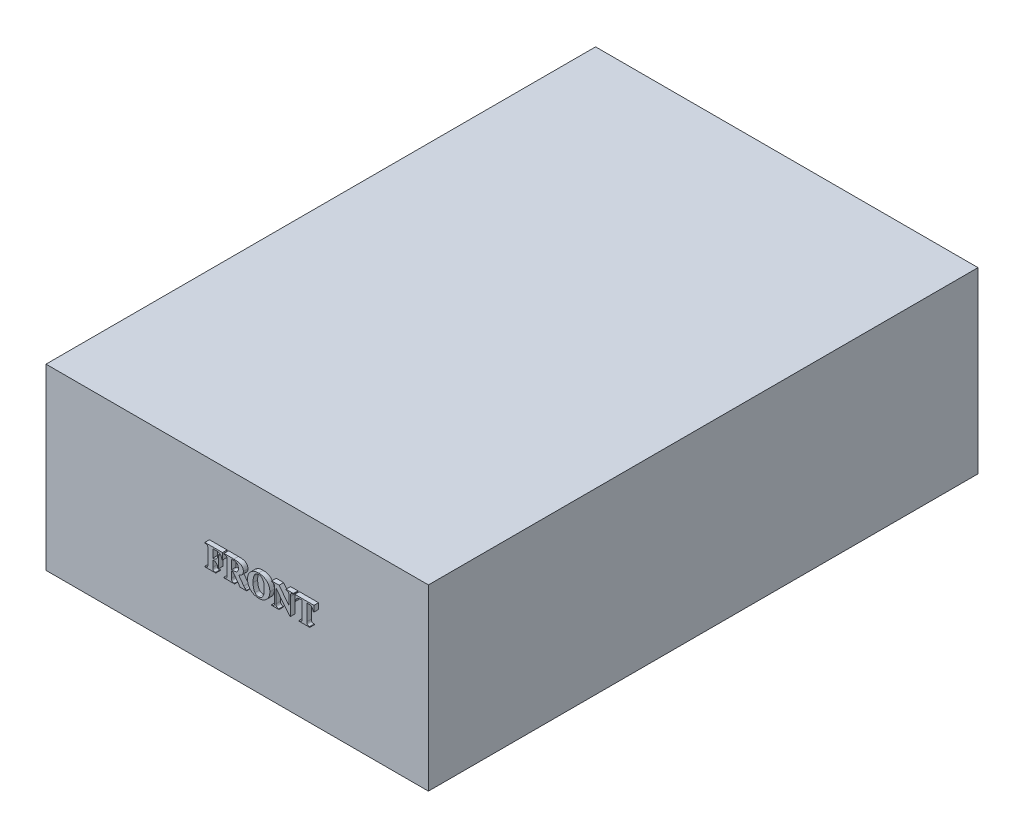
from build123d import *

# Parameters (mm, degrees)
SKETCH1_W        = 212.09
SKETCH1_H        = 99.06
EXTRUDE1_DEPTH   = 304.8
EXTRUDE2_DEPTH   = 2.54
EXTRUDE2_2_DEPTH = 2.54
EXTRUDE2_3_DEPTH = 2.54
EXTRUDE2_4_DEPTH = 2.54
EXTRUDE2_5_DEPTH = 2.54


with BuildPart() as part:
    # Sketch1 → Extrude1 (new body)
    with BuildSketch(Plane.XY):
        with Locations((0, 49.53)):
            Rectangle(SKETCH1_W, SKETCH1_H)
    extrude(amount=-EXTRUDE1_DEPTH)


with BuildPart() as body_2:
    # Sketch2 → Extrude2 (new body)
    with BuildSketch(Plane.XY):
        with BuildLine():
            Line((-10.99840617, 59.227654631), (-10.99840617, 54.661754747))
            Line((-10.99840617, 54.661754747), (-10.672270464, 54.661754747))
            add(Edge.make_bspline(
                [(-10.672270464, 54.661754747), (-10.553189256, 54.664187615), (-10.325822721, 54.668832788), (-10.001447036, 54.7174259), (-9.711750613, 54.798054357), (-9.451622702, 54.911281701), (-9.218588365, 55.066904992), (-9.007086463, 55.263927194), (-8.817123307, 55.50709918), (-8.64277164, 55.791353023), (-8.492014069, 56.126396773), (-8.370780268, 56.514603741), (-8.28069655, 56.956195192), (-8.244974844, 57.269632166), (-8.226252669, 57.433908248)],
                knots=[0, 0, 0, 0, 1.028542631, 1.963837777, 2.825873281, 3.621069556, 4.404835347, 5.235844713, 6.108193202, 7.063662138, 8.111534847, 9.274524626, 10.571545628, 12, 12, 12, 12], degree=3))
            Line((-8.226252669, 57.433908248), (-7.900116963, 57.433908248))
            Line((-7.900116963, 57.433908248), (-7.900116963, 51.07426198))
            Line((-7.900116963, 51.07426198), (-8.226252669, 51.07426198))
            add(Edge.make_bspline(
                [(-8.226252669, 51.07426198), (-8.240986117, 51.209482429), (-8.269257657, 51.468952586), (-8.332243519, 51.83943729), (-8.413045171, 52.174333255), (-8.510744557, 52.473590038), (-8.628537476, 52.735416278), (-8.760364448, 52.96276746), (-8.911024569, 53.153968168), (-9.133420947, 53.356275479), (-9.437990983, 53.551116891), (-9.828289062, 53.72244359), (-10.242888843, 53.828565375), (-10.528121391, 53.840422965), (-10.672270464, 53.846415482)],
                knots=[0, 0, 0, 0, 1.177008708, 2.258524035, 3.249721952, 4.156223051, 4.97866621, 5.729978183, 6.425618934, 7.075817341, 8.32348227, 9.534762487, 10.754133406, 12, 12, 12, 12], degree=3))
            Line((-10.672270464, 53.846415482), (-10.99840617, 53.846415482))
            Line((-10.99840617, 53.846415482), (-10.99840617, 50.258922715))
            add(Edge.make_bspline(
                [(-10.99840617, 50.258922715), (-10.997463114, 50.19012934), (-10.995658487, 50.058486746), (-10.994558459, 49.871571391), (-10.987578591, 49.704918474), (-10.973305993, 49.559050137), (-10.961952936, 49.433096663), (-10.947270204, 49.326483234), (-10.927935229, 49.241087324), (-10.897298141, 49.153397418), (-10.84113155, 49.062087398), (-10.756574451, 48.961840574), (-10.647398589, 48.870174971), (-10.516600826, 48.785296142), (-10.360351796, 48.713267064), (-10.177876334, 48.664066155), (-9.971789101, 48.633163945), (-9.826479428, 48.629941856), (-9.74991792, 48.628244185)],
                knots=[0, 0, 0, 0, 1.354319329, 2.591617395, 3.679490877, 4.636117144, 5.476222309, 6.168990776, 6.752950479, 7.19717785, 7.991448918, 8.845577426, 9.770411191, 10.785995884, 11.908144457, 13.141369476, 14.493830035, 16, 16, 16, 16], degree=3))
            Line((-9.74991792, 48.628244185), (-9.36772764, 48.628244185))
            Line((-9.36772764, 48.628244185), (-9.36772764, 48.302108479))
            Line((-9.36772764, 48.302108479), (-15.401238201, 48.302108479))
            Line((-15.401238201, 48.302108479), (-15.401238201, 48.628244185))
            Line((-15.401238201, 48.628244185), (-15.016499985, 48.628244185))
            add(Edge.make_bspline(
                [(-15.016499985, 48.628244185), (-14.936515515, 48.629738265), (-14.784270057, 48.632582152), (-14.567907363, 48.666381386), (-14.374775614, 48.719909083), (-14.260761961, 48.776836833), (-14.206256591, 48.804051714)],
                knots=[0, 0, 0, 0, 1.144467932, 2.17842344, 3.129177061, 4, 4, 4, 4], degree=3))
            add(Edge.make_bspline(
                [(-14.206256591, 48.804051714), (-14.170448623, 48.825652901), (-14.098017347, 48.869347129), (-14.00499309, 48.961903364), (-13.926162177, 49.074728273), (-13.885691783, 49.160084695), (-13.864833273, 49.204077541)],
                knots=[0, 0, 0, 0, 0.93343552, 1.888125192, 2.911536119, 4, 4, 4, 4], degree=3))
            add(Edge.make_bspline(
                [(-13.864833273, 49.204077541), (-13.85651107, 49.224259262), (-13.837553427, 49.27023241), (-13.823458421, 49.352675759), (-13.803020371, 49.453029474), (-13.792706795, 49.57514371), (-13.782302541, 49.717776165), (-13.774192632, 49.880047312), (-13.773342126, 50.062737737), (-13.771523285, 50.190980305), (-13.770559671, 50.258922715)],
                knots=[0, 0, 0, 0, 0.491154816, 1.118830903, 1.878082211, 2.802823963, 3.878617243, 5.106317376, 6.466938293, 8, 8, 8, 8], degree=3))
            Line((-13.770559671, 50.258922715), (-13.770559671, 58.08617966))
            add(Edge.make_bspline(
                [(-13.770559671, 58.08617966), (-13.771534655, 58.154970928), (-13.773400378, 58.286609488), (-13.774089177, 58.473551989), (-13.782368263, 58.640052142), (-13.792555239, 58.785276681), (-13.80367478, 58.911462983), (-13.82282828, 59.016347741), (-13.838040349, 59.102648622), (-13.870103277, 59.189066591), (-13.921168013, 59.283503624), (-14.00770402, 59.383041695), (-14.116346312, 59.474994793), (-14.247307914, 59.559785342), (-14.403506238, 59.631841749), (-14.585997123, 59.681034316), (-14.792921778, 59.712064847), (-14.939086347, 59.715198502), (-15.016499985, 59.71685819)],
                knots=[0, 0, 0, 0, 1.353963977, 2.590937397, 3.678525439, 4.633585292, 5.456840327, 6.168525469, 6.732370981, 7.176481794, 7.976852204, 8.830756602, 9.755347706, 10.770665926, 11.892520065, 13.125421506, 14.477527201, 16, 16, 16, 16], degree=3))
            Line((-15.016499985, 59.71685819), (-15.401238201, 59.71685819))
            Line((-15.401238201, 59.71685819), (-15.401238201, 60.042993896))
            Line((-15.401238201, 60.042993896), (-5.617167021, 60.042993896))
            Line((-5.617167021, 60.042993896), (-5.617167021, 56.45550113))
            Line((-5.617167021, 56.45550113), (-5.943302727, 56.45550113))
            add(Edge.make_bspline(
                [(-5.943302727, 56.45550113), (-5.954031042, 56.554180006), (-5.974828118, 56.745471167), (-6.024082188, 57.020822623), (-6.082607252, 57.276818144), (-6.150143026, 57.514107299), (-6.231379722, 57.731693599), (-6.325938853, 57.928244783), (-6.430616628, 58.10637387), (-6.587228387, 58.317311534), (-6.821222545, 58.548670813), (-7.153052569, 58.780231413), (-7.539477645, 58.967910052), (-7.822202067, 59.051688397), (-7.968911213, 59.095162)],
                knots=[0, 0, 0, 0, 0.991432477, 1.92191355, 2.792593541, 3.614306461, 4.384971491, 5.109852849, 5.790897148, 6.445967782, 7.729964095, 9.057683145, 10.473195948, 12, 12, 12, 12], degree=3))
            add(Edge.make_bspline(
                [(-7.968911213, 59.095162), (-8.015531033, 59.105808121), (-8.117562749, 59.129108126), (-8.2859577, 59.156431432), (-8.481528072, 59.178836479), (-8.704281396, 59.195632093), (-8.953941455, 59.211543111), (-9.230919412, 59.221201438), (-9.535027009, 59.225648466), (-9.746519384, 59.226966524), (-9.856931199, 59.227654631)],
                knots=[0, 0, 0, 0, 0.605076936, 1.324265919, 2.157537778, 3.095682767, 4.151012068, 5.323391552, 6.602648453, 8, 8, 8, 8], degree=3))
            Line((-9.856931199, 59.227654631), (-10.99840617, 59.227654631))
        make_face()
    extrude(amount=EXTRUDE2_DEPTH)


with BuildPart() as body_3:
    # Sketch2 → Extrude2 2 (new body)
    with BuildSketch(Plane.XY):
        with BuildLine():
            Line((-0.562063577, 53.683347629), (-0.562063577, 50.258922715))
            add(Edge.make_bspline(
                [(-0.562063577, 50.258922715), (-0.561482656, 50.188421195), (-0.560369662, 50.053346404), (-0.554585311, 49.861443225), (-0.549726334, 49.689466346), (-0.531658666, 49.539549257), (-0.51906271, 49.408924055), (-0.497753082, 49.299479487), (-0.476852901, 49.209064226), (-0.439352391, 49.117483976), (-0.377883881, 49.021809674), (-0.285211801, 48.921105908), (-0.168504166, 48.835188829), (-0.025640899, 48.755841439), (0.162664884, 48.694154141), (0.409386565, 48.659353004), (0.717138898, 48.62952439), (0.944506576, 48.628696234), (1.068614953, 48.628244185)],
                knots=[0, 0, 0, 0, 1.201607785, 2.302176191, 3.273050139, 4.131548176, 4.87492358, 5.508079405, 6.031227576, 6.453276293, 7.188288546, 7.956616343, 8.773076426, 9.647656452, 10.732595485, 12.127198207, 13.886035732, 16, 16, 16, 16], degree=3))
            Line((1.068614953, 48.628244185), (1.068614953, 48.302108479))
            Line((1.068614953, 48.302108479), (-4.801827755, 48.302108479))
            Line((-4.801827755, 48.302108479), (-4.801827755, 48.628244185))
            add(Edge.make_bspline(
                [(-4.801827755, 48.628244185), (-4.676897149, 48.628849304), (-4.447883714, 48.629958563), (-4.137987025, 48.658063657), (-3.891830317, 48.697053036), (-3.703600772, 48.7582716), (-3.563084659, 48.839850227), (-3.44761625, 48.92685501), (-3.356236542, 49.026602068), (-3.293260313, 49.120528709), (-3.256915151, 49.210927869), (-3.234790441, 49.30017063), (-3.21517463, 49.409175023), (-3.197114669, 49.539141362), (-3.184920261, 49.68969353), (-3.178165658, 49.861395525), (-3.172977587, 50.05336029), (-3.171776254, 50.188425957), (-3.171149225, 50.258922715)],
                knots=[0, 0, 0, 0, 2.130106643, 3.904752054, 5.302927616, 6.375002966, 7.257314602, 8.062903242, 8.831833611, 9.555194011, 9.977573727, 10.487113911, 11.120766299, 11.86655625, 12.724382924, 13.696018294, 14.797449837, 16, 16, 16, 16], degree=3))
            Line((-3.171149225, 50.258922715), (-3.171149225, 58.08617966))
            add(Edge.make_bspline(
                [(-3.171149225, 58.08617966), (-3.171775854, 58.156676531), (-3.172976419, 58.291742416), (-3.178169668, 58.483705713), (-3.184907792, 58.655412383), (-3.197153138, 58.805950099), (-3.215058992, 58.93596016), (-3.235271516, 59.045645486), (-3.256395171, 59.136034553), (-3.293845849, 59.227617523), (-3.355323294, 59.323312236), (-3.448043465, 59.423916769), (-3.565131092, 59.510687958), (-3.709018046, 59.588078484), (-3.896689106, 59.650948423), (-4.14221082, 59.689916586), (-4.450557085, 59.714169373), (-4.677765967, 59.715908554), (-4.801827755, 59.71685819)],
                knots=[0, 0, 0, 0, 1.201552591, 2.302070444, 3.272899798, 4.130014864, 4.875186147, 5.50831289, 6.031437031, 6.453466362, 7.188444853, 7.956737359, 8.773159939, 9.660425799, 10.731611811, 12.128627521, 13.886132833, 16, 16, 16, 16], degree=3))
            Line((-4.801827755, 59.71685819), (-4.801827755, 60.042993896))
            Line((-4.801827755, 60.042993896), (0.630370098, 60.042993896))
            add(Edge.make_bspline(
                [(0.630370098, 60.042993896), (0.801087634, 60.041828162), (1.13152983, 60.039571757), (1.609003952, 60.027654367), (2.050821536, 60.005008804), (2.457065824, 59.972520254), (2.827475625, 59.929215525), (3.163577749, 59.879423773), (3.462846675, 59.81869553), (3.731469742, 59.749997227), (3.975423964, 59.666261445), (4.205798066, 59.570917421), (4.42198399, 59.454043558), (4.630665995, 59.327411161), (4.826047486, 59.181635124), (5.011372706, 59.02100428), (5.180582917, 58.841067202), (5.341942912, 58.651332753), (5.486740732, 58.447574203), (5.614309793, 58.234008347), (5.721928359, 58.011522576), (5.808672647, 57.780144467), (5.87784898, 57.540939495), (5.926335542, 57.292001387), (5.954249313, 57.034524521), (5.958499718, 56.859840247), (5.960650543, 56.771445095)],
                knots=[0, 0, 0, 0, 1.72662054, 3.342060189, 4.830092444, 6.200416371, 7.462989327, 8.601282075, 9.635622143, 10.550256632, 11.403195303, 12.242354894, 13.068488357, 13.886138304, 14.709050263, 15.530840692, 16.363158174, 17.204513028, 18.048276074, 18.887963052, 19.717794674, 20.544196029, 21.384278329, 22.233315354, 23.106007916, 24, 24, 24, 24], degree=3))
            add(Edge.make_bspline(
                [(5.960650543, 56.771445095), (5.957605327, 56.664292203), (5.951634261, 56.454186638), (5.907805862, 56.145717792), (5.833533256, 55.852245767), (5.732111955, 55.572039748), (5.597469173, 55.308192095), (5.436094827, 55.056700467), (5.245170273, 54.818635348), (5.097644838, 54.675543629), (5.023010388, 54.603152237)],
                knots=[0, 0, 0, 0, 1.055875917, 2.070363217, 3.063103869, 4.034981426, 5.000784238, 5.975972407, 6.976026164, 8, 8, 8, 8], degree=3))
            add(Edge.make_bspline(
                [(5.023010388, 54.603152237), (4.915959464, 54.514601391), (4.69379517, 54.33083057), (4.295983387, 54.116764969), (3.844891696, 53.927941921), (3.517600396, 53.837598781), (3.346469025, 53.790360907)],
                knots=[0, 0, 0, 0, 0.884570304, 1.835761235, 2.868380718, 4, 4, 4, 4], degree=3))
            Line((3.346469025, 53.790360907), (6.172129165, 49.886924176))
            add(Edge.make_bspline(
                [(6.172129165, 49.886924176), (6.216376364, 49.825834787), (6.300585162, 49.709572873), (6.419773219, 49.542286872), (6.532048376, 49.395212628), (6.633894669, 49.2652053), (6.724489414, 49.152903087), (6.807559276, 49.059981161), (6.879037497, 48.984315665), (6.926082154, 48.942244249), (6.946701467, 48.923804669)],
                knots=[0, 0, 0, 0, 1.4621376, 2.782658633, 3.981171578, 5.048212647, 5.984136403, 6.77709185, 7.464008716, 8, 8, 8, 8], degree=3))
            add(Edge.make_bspline(
                [(6.946701467, 48.923804669), (7.005749853, 48.881760503), (7.123454381, 48.797951461), (7.32264585, 48.710157832), (7.533635512, 48.649068202), (7.680095777, 48.635252875), (7.754396926, 48.628244185)],
                knots=[0, 0, 0, 0, 0.994168701, 1.981733386, 2.976107756, 4, 4, 4, 4], degree=3))
            Line((7.754396926, 48.628244185), (7.754396926, 48.302108479))
            Line((7.754396926, 48.302108479), (4.141424808, 48.302108479))
            Line((4.141424808, 48.302108479), (0.245631882, 53.683347629))
            Line((0.245631882, 53.683347629), (-0.562063577, 53.683347629))
        make_face()
        with BuildLine():
            Line((-0.562063577, 59.390722484), (-0.562063577, 54.335619041))
            Line((-0.562063577, 54.335619041), (-0.044832731, 54.335619041))
            add(Edge.make_bspline(
                [(-0.044832731, 54.335619041), (0.057092315, 54.335895686), (0.254204748, 54.33643069), (0.540571912, 54.346546999), (0.806432989, 54.364676569), (1.053004559, 54.386871705), (1.279282146, 54.416742918), (1.485626392, 54.455475056), (1.672450398, 54.497485295), (1.891658867, 54.56460618), (2.140875585, 54.673539282), (2.410457088, 54.847294657), (2.641008539, 55.071338815), (2.840783862, 55.334328712), (2.999529438, 55.643338502), (3.110039427, 55.996560411), (3.176326306, 56.391023986), (3.184316994, 56.667554712), (3.188497042, 56.812212058)],
                knots=[0, 0, 0, 0, 1.034226387, 2.000086228, 2.907011593, 3.737991848, 4.511957121, 5.221904592, 5.867871331, 6.453975968, 7.546048523, 8.616933773, 9.689759286, 10.791177541, 11.955248141, 13.195348709, 14.532845086, 16, 16, 16, 16], degree=3))
            add(Edge.make_bspline(
                [(3.188497042, 56.812212058), (3.186682531, 56.918460622), (3.183161603, 57.124628399), (3.152077114, 57.422719857), (3.102878987, 57.700460595), (3.027301195, 57.955450709), (2.938017346, 58.19223851), (2.821694371, 58.403912744), (2.688704308, 58.596371579), (2.53142139, 58.764653519), (2.353562036, 58.916373953), (2.147299531, 59.041611974), (1.919859457, 59.153480428), (1.664633071, 59.238085298), (1.386002216, 59.306514985), (1.082989237, 59.357913104), (0.75400283, 59.384555683), (0.526797498, 59.388613365), (0.408699735, 59.390722484)],
                knots=[0, 0, 0, 0, 1.16430214, 2.25924543, 3.281782595, 4.251104685, 5.170830437, 6.049791735, 6.891787854, 7.728466103, 8.567626776, 9.445897571, 10.366094373, 11.340588595, 12.386009021, 13.509395102, 14.705422703, 16, 16, 16, 16], degree=3))
            Line((0.408699735, 59.390722484), (-0.562063577, 59.390722484))
        make_face(mode=Mode.SUBTRACT)
    extrude(amount=EXTRUDE2_2_DEPTH)


with BuildPart() as body_4:
    # Sketch2 → Extrude2 3 (new body)
    with BuildSketch(Plane.XY):
        with BuildLine():
            add(Edge.make_bspline(
                [(14.363740844, 60.206061749), (14.590633571, 60.209599463), (15.034331688, 60.216517609), (15.6852228, 60.15262507), (16.303970866, 60.036714168), (16.890922096, 59.864489743), (17.44279095, 59.629751435), (17.963796679, 59.34060554), (18.451855571, 58.992845053), (18.901041487, 58.590277269), (19.30568025, 58.146816656), (19.662927376, 57.673325641), (19.96510159, 57.172398281), (20.210886188, 56.643369468), (20.403613138, 56.087867533), (20.536741142, 55.504226097), (20.62100036, 54.894372083), (20.631440278, 54.478584728), (20.636757314, 54.26682479)],
                knots=[0, 0, 0, 0, 1.117599178, 2.185511443, 3.216596641, 4.216496892, 5.193720437, 6.166199278, 7.147635958, 8.140749636, 9.133263309, 10.101842832, 11.059452728, 12.010747998, 12.971773146, 13.951566087, 14.956735376, 16, 16, 16, 16], degree=3))
            add(Edge.make_bspline(
                [(20.636757314, 54.26682479), (20.632945951, 54.084900349), (20.625425789, 53.725947103), (20.562518726, 53.19587031), (20.460023955, 52.682485842), (20.321309991, 52.183669192), (20.136713017, 51.703062343), (19.910002296, 51.240942813), (19.64980259, 50.791088431), (19.442048419, 50.511822275), (19.33731036, 50.371031864)],
                knots=[0, 0, 0, 0, 1.043246653, 2.058419255, 3.056808262, 4.043829632, 5.024555343, 6.005002729, 6.994233708, 8, 8, 8, 8], degree=3))
            add(Edge.make_bspline(
                [(19.33731036, 50.371031864), (19.26452355, 50.280059542), (19.120362869, 50.099880854), (18.886298764, 49.848077279), (18.645983205, 49.609238872), (18.388910206, 49.39352798), (18.124585384, 49.191413884), (17.848338052, 49.00697293), (17.560235997, 48.841827146), (17.261678669, 48.693486726), (16.951485088, 48.563772821), (16.631606879, 48.447981679), (16.298029532, 48.35495707), (15.954773288, 48.275440333), (15.600013515, 48.214282127), (15.235031787, 48.172400999), (14.859406419, 48.141802263), (14.605010083, 48.139970589), (14.475849992, 48.139040626)],
                knots=[0, 0, 0, 0, 1.00627325, 1.9930127, 2.968556301, 3.931628562, 4.889992766, 5.842467438, 6.799060146, 7.757311971, 8.720859362, 9.702647782, 10.694476427, 11.710892394, 12.745970349, 13.802697082, 14.884402792, 16, 16, 16, 16], degree=3))
            add(Edge.make_bspline(
                [(14.475849992, 48.139040626), (14.346705551, 48.140223349), (14.091553035, 48.142560072), (13.714175801, 48.169722641), (13.347505703, 48.209109571), (12.991838552, 48.267552081), (12.648299559, 48.345851373), (12.313326848, 48.432074859), (11.992611745, 48.543228172), (11.682579408, 48.669053701), (11.381934282, 48.807778949), (11.093328951, 48.966105063), (10.817849727, 49.143081631), (10.552544463, 49.334523786), (10.296653212, 49.540388168), (10.054339014, 49.766217793), (9.822123468, 50.007891841), (9.677159367, 50.179962241), (9.604197884, 50.266566521)],
                knots=[0, 0, 0, 0, 1.12499151, 2.222661784, 3.294793131, 4.33735381, 5.360698186, 6.364076506, 7.349253377, 8.315262806, 9.278632822, 10.232406028, 11.180767221, 12.129590213, 13.081869556, 14.040110377, 15.013573345, 16, 16, 16, 16], degree=3))
            add(Edge.make_bspline(
                [(9.604197884, 50.266566521), (9.495486011, 50.408295821), (9.279269607, 50.69018039), (9.001973982, 51.142395494), (8.768900455, 51.614582564), (8.577323302, 52.105677851), (8.42642665, 52.616099293), (8.319831354, 53.146378088), (8.254298655, 53.696127034), (8.247202566, 54.069600375), (8.243600485, 54.259180984)],
                knots=[0, 0, 0, 0, 0.995754374, 1.980450006, 2.952842694, 3.929288476, 4.917067138, 5.917621276, 6.942953664, 8, 8, 8, 8], degree=3))
            add(Edge.make_bspline(
                [(8.243600485, 54.259180984), (8.249058337, 54.470909522), (8.259774744, 54.886635223), (8.342087458, 55.497323804), (8.482737946, 56.079977537), (8.677488842, 56.636468037), (8.924938158, 57.16682784), (9.230246634, 57.668935237), (9.59264743, 58.142663266), (10.005488124, 58.584801234), (10.45685175, 58.986722285), (10.938558894, 59.33761792), (11.448297208, 59.625517313), (11.982262054, 59.859975484), (12.541831825, 60.036223288), (13.127829582, 60.152395548), (13.738075356, 60.216340112), (14.152976063, 60.209524169), (14.363740844, 60.206061749)],
                knots=[0, 0, 0, 0, 1.060255294, 2.081794832, 3.079505486, 4.0575798, 5.030022739, 6.005429218, 6.99491703, 8.012249652, 9.030720031, 10.017772549, 10.991257006, 11.957043232, 12.933793802, 13.923226749, 14.945023109, 16, 16, 16, 16], degree=3))
        make_face()
        with BuildLine():
            add(Edge.make_bspline(
                [(14.465658252, 59.553790337), (14.335282212, 59.549266607), (14.080663873, 59.540431973), (13.712011242, 59.460328769), (13.366412902, 59.336656414), (13.046353732, 59.156284753), (12.748467796, 58.929085781), (12.479822668, 58.645593833), (12.233468577, 58.315258759), (12.095814705, 58.068409437), (12.024736327, 57.940947353)],
                knots=[0, 0, 0, 0, 1.010341478, 1.973149883, 2.913323355, 3.848402755, 4.811842333, 5.809142135, 6.868737798, 8, 8, 8, 8], degree=3))
            add(Edge.make_bspline(
                [(12.024736327, 57.940947353), (11.968936504, 57.825559131), (11.853445478, 57.586735716), (11.720213786, 57.197578775), (11.602018706, 56.774957107), (11.505920831, 56.316197463), (11.433393345, 55.820848864), (11.380788121, 55.290303458), (11.346582253, 54.724203437), (11.343484633, 54.334821752), (11.341889692, 54.13433216)],
                knots=[0, 0, 0, 0, 0.787943638, 1.630837067, 2.525905988, 3.487208031, 4.51219802, 5.604605297, 6.766629954, 8, 8, 8, 8], degree=3))
            add(Edge.make_bspline(
                [(11.341889692, 54.13433216), (11.344105598, 53.896413291), (11.348392625, 53.436120932), (11.401518601, 52.770273767), (11.480456671, 52.152135529), (11.594224846, 51.582174377), (11.741392314, 51.059406836), (11.921157843, 50.584544825), (12.133634359, 50.155333324), (12.308797904, 49.901232481), (12.394186931, 49.777362962)],
                knots=[0, 0, 0, 0, 1.253361503, 2.424829634, 3.517270749, 4.535371114, 5.484506921, 6.375489106, 7.20808062, 8, 8, 8, 8], degree=3))
            add(Edge.make_bspline(
                [(12.394186931, 49.777362962), (12.456880641, 49.698410939), (12.579418032, 49.544096018), (12.792820942, 49.343380541), (13.021888454, 49.16998983), (13.274358745, 49.034189313), (13.540465331, 48.921675555), (13.827006382, 48.846446593), (14.131163182, 48.799510797), (14.340629711, 48.794087415), (14.447822705, 48.791312038)],
                knots=[0, 0, 0, 0, 1.020058884, 1.99374635, 2.959073536, 3.921751619, 4.889988268, 5.879249688, 6.914721236, 8, 8, 8, 8], degree=3))
            add(Edge.make_bspline(
                [(14.447822705, 48.791312038), (14.590170777, 48.795242796), (14.865517213, 48.80284613), (15.258738929, 48.88863343), (15.62037544, 49.016356274), (15.830050893, 49.150688693), (15.933268929, 49.216817217)],
                knots=[0, 0, 0, 0, 1.086516288, 2.101667992, 3.065498145, 4, 4, 4, 4], degree=3))
            add(Edge.make_bspline(
                [(15.933268929, 49.216817217), (15.995239627, 49.264220483), (16.121180649, 49.360556588), (16.297653724, 49.526423385), (16.459319522, 49.716490473), (16.61351459, 49.923622698), (16.755756619, 50.151507373), (16.889032317, 50.398610111), (17.007094525, 50.668242495), (17.121079083, 50.95612083), (17.218758082, 51.267254347), (17.307154207, 51.600077273), (17.375329979, 51.956501539), (17.438644214, 52.334132652), (17.482514642, 52.734871736), (17.516605329, 53.157953958), (17.532857148, 53.604237664), (17.536567196, 53.90925612), (17.538468107, 54.065537909)],
                knots=[0, 0, 0, 0, 0.707878774, 1.438598863, 2.192768746, 2.969795667, 3.780358143, 4.628744544, 5.515519471, 6.450279976, 7.437595481, 8.473401936, 9.573958948, 10.729714514, 11.947871327, 13.231394215, 14.581454142, 16, 16, 16, 16], degree=3))
            add(Edge.make_bspline(
                [(17.538468107, 54.065537909), (17.536907251, 54.249858424), (17.533885246, 54.606725163), (17.513395464, 55.124168886), (17.480800347, 55.605994171), (17.435963576, 56.052390769), (17.376445362, 56.462608502), (17.298040237, 56.835999301), (17.215081222, 57.175247671), (17.111130532, 57.479051566), (16.996742051, 57.752947675), (16.881447103, 58.007429705), (16.752530344, 58.238069104), (16.622232651, 58.45198005), (16.477712936, 58.639712724), (16.330373506, 58.810800465), (16.17196543, 58.957848153), (15.954761869, 59.127672525), (15.664179505, 59.301248302), (15.286401832, 59.446116065), (14.884707096, 59.540091152), (14.607180358, 59.549163818), (14.465658252, 59.553790337)],
                knots=[0, 0, 0, 0, 1.564715362, 3.029477591, 4.395383686, 5.663787164, 6.837420581, 7.912070591, 8.901835802, 9.800165859, 10.634314221, 11.421391877, 12.170015688, 12.876189058, 13.5452815, 14.178775877, 14.79090283, 15.376466922, 16.517763855, 17.647800425, 18.800518316, 20, 20, 20, 20], degree=3))
        make_face(mode=Mode.SUBTRACT)
    extrude(amount=EXTRUDE2_3_DEPTH)


with BuildPart() as body_5:
    # Sketch2 → Extrude2 4 (new body)
    with BuildSketch(Plane.XY):
        with BuildLine():
            Line((25.763202943, 60.042993896), (31.23616776, 53.094774597))
            Line((31.23616776, 53.094774597), (31.23616776, 57.760043954))
            add(Edge.make_bspline(
                [(31.23616776, 57.760043954), (31.234991496, 57.846680182), (31.232741413, 58.012407145), (31.221300694, 58.249774983), (31.197258282, 58.464660481), (31.169394308, 58.659535619), (31.125002055, 58.830852062), (31.077540494, 58.981691481), (31.020158209, 59.111283283), (30.969703324, 59.184963103), (30.945703146, 59.220010825)],
                knots=[0, 0, 0, 0, 1.37708922, 2.634242248, 3.774587307, 4.813165717, 5.759297908, 6.583135444, 7.326031535, 8, 8, 8, 8], degree=3))
            add(Edge.make_bspline(
                [(30.945703146, 59.220010825), (30.910229737, 59.260946206), (30.839178175, 59.342937841), (30.712573604, 59.448490479), (30.568754533, 59.535110679), (30.408187086, 59.604187241), (30.231158845, 59.657243627), (30.037542898, 59.695366838), (29.826736038, 59.715191785), (29.68111652, 59.716288574), (29.605489229, 59.71685819)],
                knots=[0, 0, 0, 0, 0.876036587, 1.754659902, 2.655600339, 3.585565811, 4.577428142, 5.642743129, 6.775761992, 8, 8, 8, 8], degree=3))
            Line((29.605489229, 59.71685819), (29.605489229, 60.042993896))
            Line((29.605489229, 60.042993896), (33.682185555, 60.042993896))
            Line((33.682185555, 60.042993896), (33.682185555, 59.71685819))
            add(Edge.make_bspline(
                [(33.682185555, 59.71685819), (33.561297496, 59.70164315), (33.340549934, 59.673859738), (33.043911435, 59.611913209), (32.809742448, 59.549252489), (32.630061687, 59.474639875), (32.492738293, 59.378246631), (32.380335533, 59.260777203), (32.279811729, 59.121618028), (32.192107165, 58.952121204), (32.125533529, 58.737213186), (32.083722089, 58.46637014), (32.056542732, 58.134293325), (32.053279271, 57.891755736), (32.051507025, 57.760043954)],
                knots=[0, 0, 0, 0, 1.47293099, 2.689644668, 3.661742309, 4.402208035, 5.02909861, 5.67554278, 6.359727415, 7.099337769, 7.973129416, 9.067356349, 10.407406766, 12, 12, 12, 12], degree=3))
            Line((32.051507025, 57.760043954), (32.051507025, 48.139040626))
            Line((32.051507025, 48.139040626), (31.67696055, 48.139040626))
            Line((31.67696055, 48.139040626), (24.061182227, 57.813550593))
            Line((24.061182227, 57.813550593), (24.061182227, 50.258922715))
            add(Edge.make_bspline(
                [(24.061182227, 50.258922715), (24.063053767, 50.182465437), (24.066656448, 50.035286516), (24.082662215, 49.82378657), (24.115945038, 49.63206245), (24.161516195, 49.459570647), (24.21953474, 49.306252972), (24.290241175, 49.170998068), (24.378490813, 49.058376545), (24.508006678, 48.932122442), (24.692388917, 48.81266179), (24.928395296, 48.705126956), (25.18041414, 48.639045595), (25.354297776, 48.631870062), (25.442163107, 48.628244185)],
                knots=[0, 0, 0, 0, 1.127047964, 2.169547561, 3.122229636, 3.990523395, 4.794755099, 5.533929617, 6.229880341, 6.893690072, 8.19195966, 9.44115978, 10.706989644, 12, 12, 12, 12], degree=3))
            Line((25.442163107, 48.628244185), (25.691860757, 48.628244185))
            Line((25.691860757, 48.628244185), (25.691860757, 48.302108479))
            Line((25.691860757, 48.302108479), (21.615164432, 48.302108479))
            Line((21.615164432, 48.302108479), (21.615164432, 48.628244185))
            add(Edge.make_bspline(
                [(21.615164432, 48.628244185), (21.688242913, 48.630005826), (21.828673674, 48.63339107), (22.031326438, 48.650898482), (22.217392011, 48.680238541), (22.385373884, 48.724782907), (22.537601422, 48.773994298), (22.671671298, 48.837689765), (22.787192232, 48.915413596), (22.888772347, 49.002378746), (22.974782496, 49.105199935), (23.048586114, 49.222555632), (23.109621765, 49.357476772), (23.160108282, 49.506796827), (23.198036923, 49.67251994), (23.225180663, 49.853091045), (23.244000407, 50.05045001), (23.24521199, 50.1875325), (23.245842962, 50.258922715)],
                knots=[0, 0, 0, 0, 1.302254148, 2.502467739, 3.622024049, 4.653421555, 5.596190003, 6.46934253, 7.287800068, 8.07079221, 8.843923894, 9.666846287, 10.533548967, 11.476317415, 12.471093534, 13.558375583, 14.728443775, 16, 16, 16, 16], degree=3))
            Line((23.245842962, 50.258922715), (23.245842962, 58.84546435))
            Line((23.245842962, 58.84546435), (23.105706526, 59.021271879))
            add(Edge.make_bspline(
                [(23.105706526, 59.021271879), (23.047317546, 59.085989304), (22.937359245, 59.20786535), (22.767636171, 59.363267554), (22.608048801, 59.482805052), (22.453668089, 59.57391005), (22.286253099, 59.632526209), (22.097332107, 59.680073408), (21.876451954, 59.704687965), (21.71881494, 59.712651625), (21.635547914, 59.71685819)],
                knots=[0, 0, 0, 0, 1.235439228, 2.326582838, 3.256262787, 4.059856782, 4.856199611, 5.761619077, 6.817642388, 8, 8, 8, 8], degree=3))
            Line((21.635547914, 59.71685819), (21.635547914, 60.042993896))
            Line((21.635547914, 60.042993896), (25.763202943, 60.042993896))
        make_face()
    extrude(amount=EXTRUDE2_4_DEPTH)


with BuildPart() as body_6:
    # Sketch2 → Extrude2 5 (new body)
    with BuildSketch(Plane.XY):
        with BuildLine():
            Line((45.096935265, 60.042993896), (45.096935265, 56.781636836))
            Line((45.096935265, 56.781636836), (44.770799559, 56.781636836))
            add(Edge.make_bspline(
                [(44.770799559, 56.781636836), (44.726946692, 56.948678533), (44.645031077, 57.260706556), (44.501776281, 57.686470842), (44.350622525, 58.037481712), (44.186354577, 58.321595875), (44.000853888, 58.555091845), (43.788757042, 58.754821344), (43.548560874, 58.933432459), (43.369176409, 59.027045756), (43.27770953, 59.074778519)],
                knots=[0, 0, 0, 0, 1.457214957, 2.722026344, 3.787486567, 4.677495633, 5.483472642, 6.294659805, 7.130459019, 8, 8, 8, 8], degree=3))
            add(Edge.make_bspline(
                [(43.27770953, 59.074778519), (43.215411299, 59.098755674), (43.073825297, 59.153248867), (42.821383124, 59.19550392), (42.511442044, 59.222631856), (42.284961543, 59.225884556), (42.161713911, 59.227654631)],
                knots=[0, 0, 0, 0, 0.705326227, 1.603004102, 2.695587181, 4, 4, 4, 4], degree=3))
            Line((42.161713911, 59.227654631), (41.183306793, 59.227654631))
            Line((41.183306793, 59.227654631), (41.183306793, 50.258922715))
            add(Edge.make_bspline(
                [(41.183306793, 50.258922715), (41.184249857, 50.190129346), (41.186054499, 50.058486766), (41.187154423, 49.871571324), (41.194134621, 49.704918682), (41.208406202, 49.559049497), (41.219762337, 49.433098588), (41.23443623, 49.32647779), (41.253795992, 49.241102547), (41.284347943, 49.153341655), (41.340790196, 49.062968012), (41.422376923, 48.960960369), (41.531960993, 48.870338818), (41.662503246, 48.785240924), (41.818834802, 48.713303261), (42.002083914, 48.663752749), (42.209951899, 48.633236015), (42.356938901, 48.629966125), (42.434342978, 48.628244185)],
                knots=[0, 0, 0, 0, 1.352414483, 2.587972293, 3.674315684, 4.629596459, 5.468520019, 6.160314109, 6.743452474, 7.187055041, 7.980208969, 8.822448445, 9.745981434, 10.760137711, 11.880707985, 13.112198476, 14.47926954, 16, 16, 16, 16], degree=3))
            Line((42.434342978, 48.628244185), (42.813985323, 48.628244185))
            Line((42.813985323, 48.628244185), (42.813985323, 48.302108479))
            Line((42.813985323, 48.302108479), (36.780474762, 48.302108479))
            Line((36.780474762, 48.302108479), (36.780474762, 48.628244185))
            Line((36.780474762, 48.628244185), (37.162665042, 48.628244185))
            add(Edge.make_bspline(
                [(37.162665042, 48.628244185), (37.242640419, 48.629769503), (37.394868569, 48.632672849), (37.610541297, 48.665945269), (37.80252325, 48.720447507), (37.915839403, 48.776893302), (37.970360502, 48.804051714)],
                knots=[0, 0, 0, 0, 1.147815573, 2.184795468, 3.126629849, 4, 4, 4, 4], degree=3))
            add(Edge.make_bspline(
                [(37.970360502, 48.804051714), (38.006203328, 48.825626011), (38.078705114, 48.869265847), (38.171529831, 48.962600646), (38.253093254, 49.074443973), (38.295204333, 49.16002658), (38.316879689, 49.204077541)],
                knots=[0, 0, 0, 0, 0.928829741, 1.878808762, 2.908183361, 4, 4, 4, 4], degree=3))
            add(Edge.make_bspline(
                [(38.316879689, 49.204077541), (38.325201893, 49.224259262), (38.344159536, 49.27023241), (38.358254542, 49.352675759), (38.378692592, 49.453029474), (38.389006168, 49.57514371), (38.399410422, 49.717776165), (38.407520331, 49.880047312), (38.408370837, 50.062737737), (38.410189678, 50.190980305), (38.411153292, 50.258922715)],
                knots=[0, 0, 0, 0, 0.491154816, 1.118830903, 1.878082211, 2.802823963, 3.878617243, 5.106317376, 6.466938293, 8, 8, 8, 8], degree=3))
            Line((38.411153292, 50.258922715), (38.411153292, 59.227654631))
            Line((38.411153292, 59.227654631), (37.432746174, 59.227654631))
            add(Edge.make_bspline(
                [(37.432746174, 59.227654631), (37.339269422, 59.226328123), (37.159655962, 59.223779268), (36.900024455, 59.200463561), (36.659790385, 59.16278203), (36.438737957, 59.110306489), (36.236548832, 59.041748605), (36.056516605, 58.954312444), (35.892637405, 58.85643302), (35.799334267, 58.775516533), (35.753656875, 58.735903137)],
                knots=[0, 0, 0, 0, 1.253047779, 2.407702914, 3.491633713, 4.510764096, 5.450666339, 6.347071276, 7.190793839, 8, 8, 8, 8], degree=3))
            add(Edge.make_bspline(
                [(35.753656875, 58.735903137), (35.693709431, 58.676826463), (35.573430475, 58.558294628), (35.416084274, 58.356659582), (35.272540018, 58.140093917), (35.146765482, 57.903889647), (35.04164004, 57.648693316), (34.948406519, 57.376952631), (34.874618656, 57.086301162), (34.840896641, 56.884686719), (34.823660526, 56.781636836)],
                knots=[0, 0, 0, 0, 0.914922114, 1.835705892, 2.776354923, 3.739610741, 4.741925865, 5.776441286, 6.863486844, 8, 8, 8, 8], degree=3))
            Line((34.823660526, 56.781636836), (34.49752482, 56.781636836))
            Line((34.49752482, 56.781636836), (34.49752482, 60.042993896))
            Line((34.49752482, 60.042993896), (45.096935265, 60.042993896))
        make_face()
    extrude(amount=EXTRUDE2_5_DEPTH)


solid = Compound([part.part, body_2.part, body_3.part, body_4.part, body_5.part, body_6.part])
